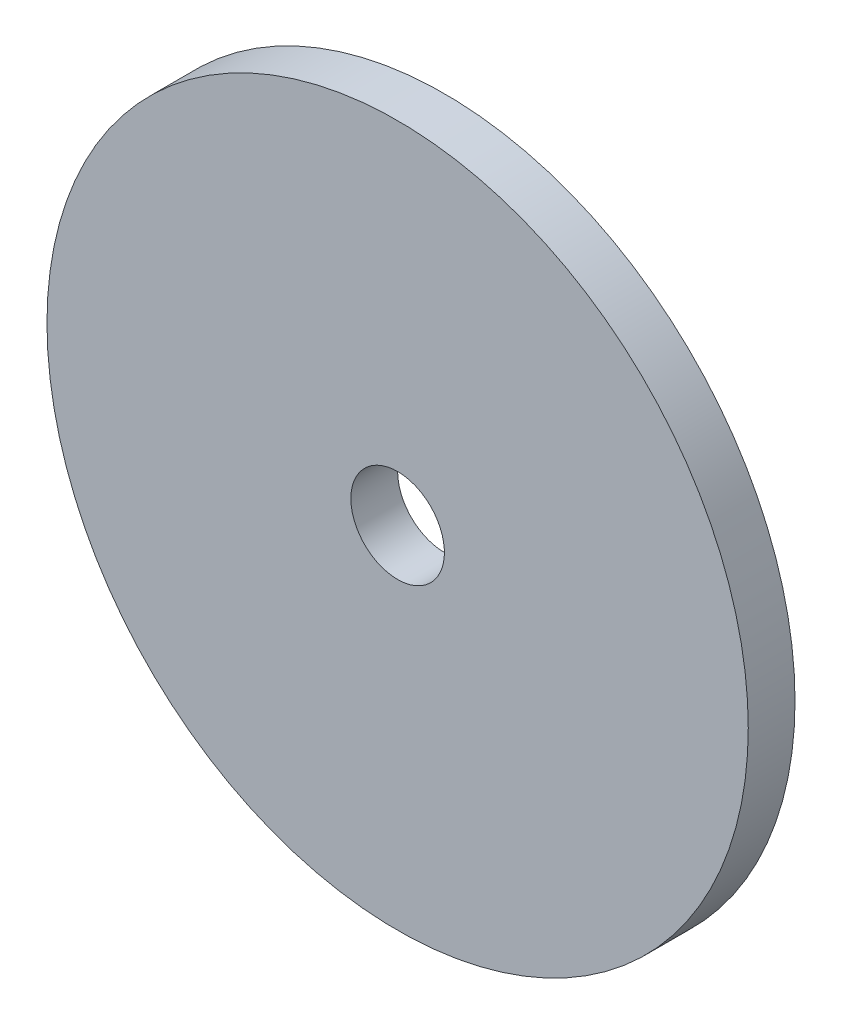
from build123d import *

# Parameters (mm, degrees)
SKETCH_1_R      = 11.25
EXTRUDE_1_DEPTH = 1.5
SKETCH_3_W      = 1.5
SKETCH_3_H      = 1.5


with BuildPart() as part:
    # 草图1 → 凸台-拉伸1 (new body)
    with BuildSketch(Plane.XY):
        Circle(SKETCH_1_R)
    extrude(amount=EXTRUDE_1_DEPTH)

    # 草图3 → 切除-旋转1 (revolve, cut)
    with BuildSketch(Plane(origin=(0, 0, 0), x_dir=(1, 0, 0), z_dir=(0, 1, 0)), mode=Mode.PRIVATE) as cut_revolve_1_sk:
        with Locations((0.75, -0.75)):
            Rectangle(SKETCH_3_W, SKETCH_3_H)
    revolve(cut_revolve_1_sk.sketch.rotate(Axis((0, 0, 0), (0, 0, 1)), 180), axis=Axis((0, 0, 0), (0, 0, 1)), mode=Mode.SUBTRACT)


solid = part.part
